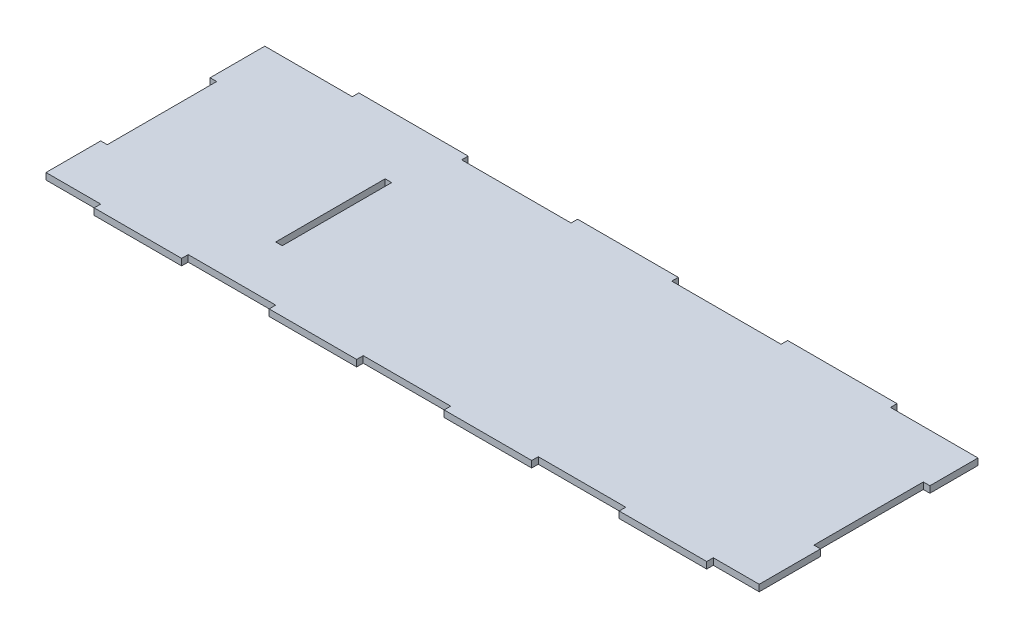
from build123d import *

# Parameters (mm, degrees)
SKETCH1_W           = 326
SKETCH1_H           = 3
BOSS_EXTRUDE1_DEPTH = 100
SKETCH2_W           = 50
SKETCH2_H           = 3
SKETCH2_W_2         = 46
BOSS_EXTRUDE2_DEPTH = 3
SKETCH3_W           = 3
SKETCH3_H           = 50
CUT_EXTRUDE1_DEPTH  = 6
SKETCH4_W           = 3
SKETCH4_H           = 50
CUT_EXTRUDE2_DEPTH  = 6
SKETCH5_W           = 3
SKETCH5_H           = 50
CUT_EXTRUDE3_DEPTH  = 6
SKETCH6_W           = 40
SKETCH6_H           = 3
BOSS_EXTRUDE3_DEPTH = 3


with BuildPart() as part:
    # Sketch1 → Boss-Extrude1 (new body)
    with BuildSketch(Plane.XY):
        with Locations((0, -1.5)):
            Rectangle(SKETCH1_W, SKETCH1_H)
    extrude(amount=BOSS_EXTRUDE1_DEPTH)

    # Sketch2 → Boss-Extrude2 (add)
    with BuildSketch(Plane(origin=(0, 0, 0), x_dir=(-1, 0, 0), z_dir=(0, 0, -1))):
        with Locations((-98, -1.5)):
            Rectangle(SKETCH2_W, SKETCH2_H)
        with Locations((0, -1.5)):
            Rectangle(SKETCH2_W_2, SKETCH2_H)
        with Locations((98, -1.5)):
            Rectangle(SKETCH2_W, SKETCH2_H)
    extrude(amount=BOSS_EXTRUDE2_DEPTH)

    # Sketch3 → Cut-Extrude1 (cut)
    with BuildSketch(Plane.XZ.offset(3)):
        with Locations((-161.5, 50)):
            Rectangle(SKETCH3_W, SKETCH3_H)
    extrude(amount=-CUT_EXTRUDE1_DEPTH, mode=Mode.SUBTRACT)

    # Sketch4 → Cut-Extrude2 (cut)
    with BuildSketch(Plane.XZ.offset(3)):
        with Locations((-81.5, 50)):
            Rectangle(SKETCH4_W, SKETCH4_H)
    extrude(amount=-CUT_EXTRUDE2_DEPTH, mode=Mode.SUBTRACT)

    # Sketch5 → Cut-Extrude3 (cut)
    with BuildSketch(Plane.XZ.offset(3)):
        with Locations((161.5, 47)):
            Rectangle(SKETCH5_W, SKETCH5_H)
    extrude(amount=-CUT_EXTRUDE3_DEPTH, mode=Mode.SUBTRACT)

    # Sketch6 → Boss-Extrude3 (add)
    with BuildSketch(Plane.XY.offset(100)):
        with Locations((-118, -1.5)):
            Rectangle(SKETCH6_W, SKETCH6_H)
        with Locations((-38, -1.5)):
            Rectangle(SKETCH6_W, SKETCH6_H)
        with Locations((42, -1.5)):
            Rectangle(SKETCH6_W, SKETCH6_H)
        with Locations((122, -1.5)):
            Rectangle(SKETCH6_W, SKETCH6_H)
    extrude(amount=BOSS_EXTRUDE3_DEPTH)


solid = part.part
